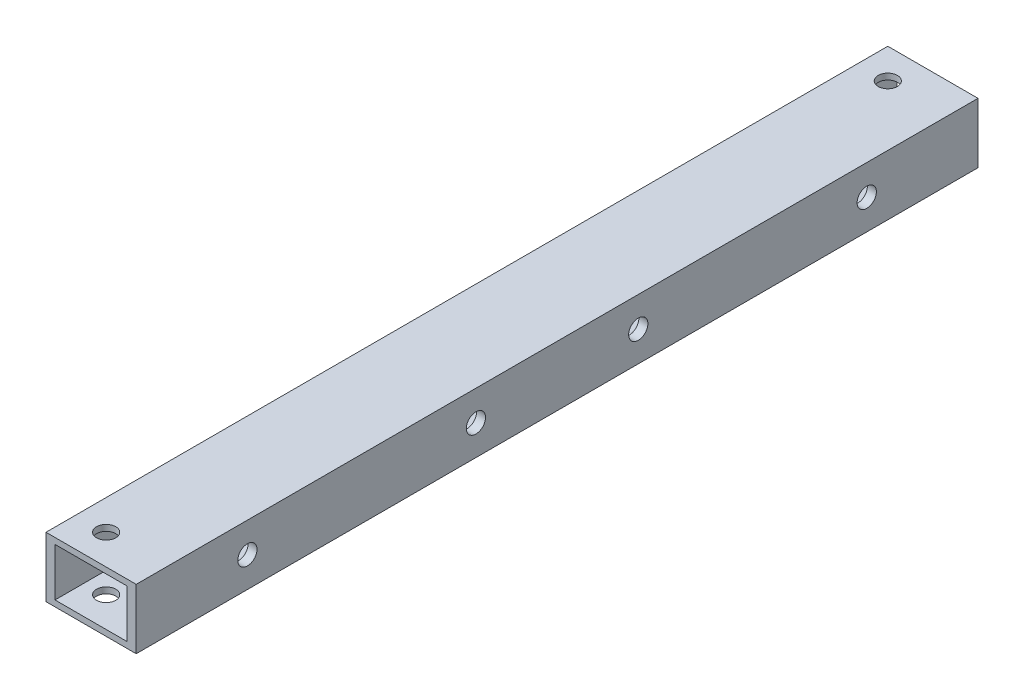
from build123d import *

# Parameters (mm, degrees)
SKETCH_1_W          = 15
SKETCH_1_H          = 10
SKETCH_1_W_2        = 12
SKETCH_1_H_2        = 8
EXTRUDE_1_DEPTH     = 70
SKETCH_2_R          = 1.6
CUT_EXTRUDE_1_DEPTH = 72.763500472
SKETCH_3_R          = 1.6
CUT_EXTRUDE_2_DEPTH = 72.107313267
SKETCH_4_R          = 1.6
CUT_EXTRUDE_3_DEPTH = 72.763500472


with BuildPart() as part:
    # ｽｹｯﾁ1 → ﾎﾞｽ - 押し出し1 (new body)
    with BuildSketch(Plane.XY):
        Rectangle(SKETCH_1_W, SKETCH_1_H)
        Rectangle(SKETCH_1_W_2, SKETCH_1_H_2, mode=Mode.SUBTRACT)
    extrude_1 = extrude(amount=EXTRUDE_1_DEPTH)

    # ｽｹｯﾁ2 → ｶｯﾄ - 押し出し1 (cut, through all)
    with BuildSketch(Plane(origin=(7.5, 0, 0), x_dir=(0, 0, -1), z_dir=(1, 0, 0))):
        with Locations((-13.5, 0)):
            Circle(SKETCH_2_R)
    cut_extrude_1 = extrude(amount=-CUT_EXTRUDE_1_DEPTH, mode=Mode.SUBTRACT)

    # ｽｹｯﾁ3 → ｶｯﾄ - 押し出し2 (cut, through all)
    with BuildSketch(Plane(origin=(0, 5, 0), x_dir=(1, 0, 0), z_dir=(0, 1, 0))):
        with Locations(Location((-2.5, -65, 0), (0, 0, 270))):
            Circle(SKETCH_3_R)
    cut_extrude_2 = extrude(amount=-CUT_EXTRUDE_2_DEPTH, mode=Mode.SUBTRACT)

    # ｽｹｯﾁ4 → ｶｯﾄ - 押し出し3 (cut, through all)
    with BuildSketch(Plane.ZY.offset(7.5)):
        with Locations((51.5, 0)):
            Circle(SKETCH_4_R)
    cut_extrude_3 = extrude(amount=-CUT_EXTRUDE_3_DEPTH, mode=Mode.SUBTRACT)

    # ﾐﾗｰ1: ﾎﾞｽ - 押し出し1, ｶｯﾄ - 押し出し1, ｶｯﾄ - 押し出し2, ｶｯﾄ - 押し出し3 across plane
    add(extrude_1.mirror(Plane(origin=(0, 0, 0), x_dir=(1, 0, 0), z_dir=(0, 0, -1))))
    add(cut_extrude_1.mirror(Plane(origin=(0, 0, 0), x_dir=(1, 0, 0), z_dir=(0, 0, -1))), mode=Mode.SUBTRACT)
    add(cut_extrude_2.mirror(Plane(origin=(0, 0, 0), x_dir=(1, 0, 0), z_dir=(0, 0, -1))), mode=Mode.SUBTRACT)
    add(cut_extrude_3.mirror(Plane(origin=(0, 0, 0), x_dir=(1, 0, 0), z_dir=(0, 0, -1))), mode=Mode.SUBTRACT)


solid = part.part
